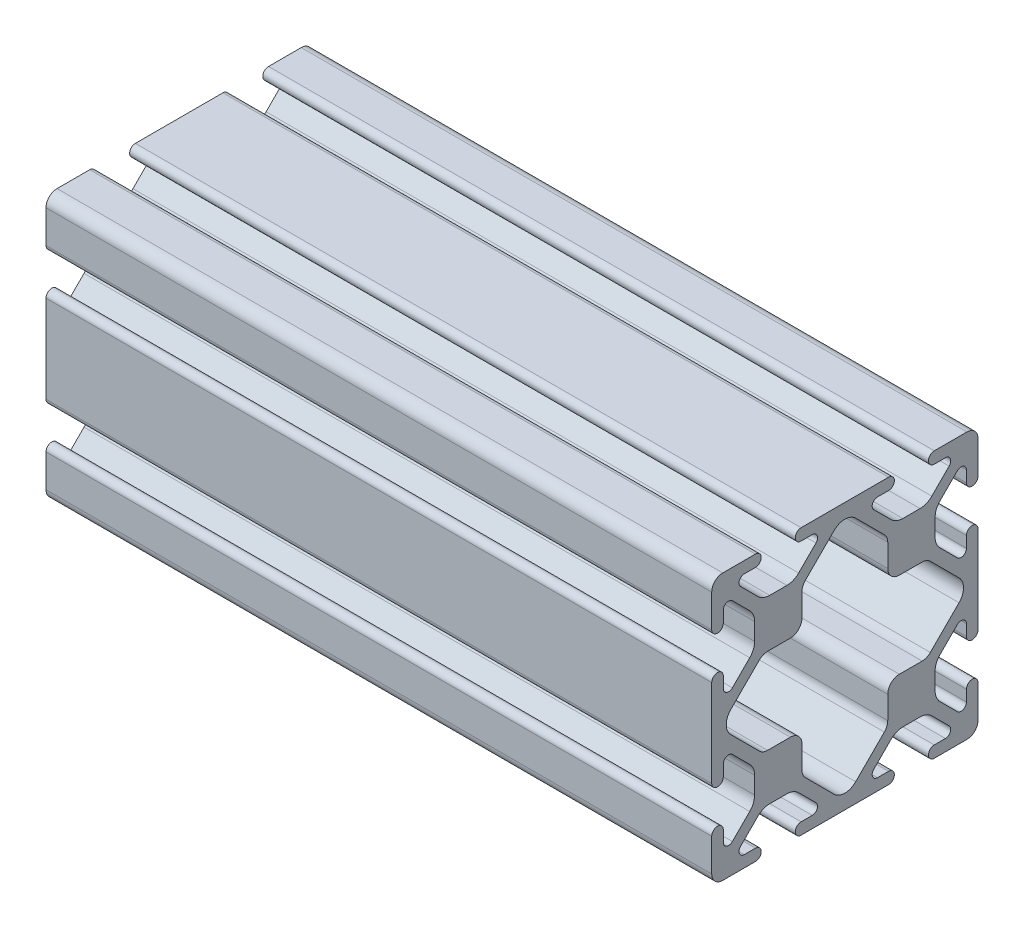
from build123d import *

# Parameters (mm, degrees)
BOSS_EXTRUDE1_DEPTH = 127


with BuildPart() as part:
    # Sketch1 → Boss-Extrude1 (new body)
    with BuildSketch(Plane(origin=(0, 0, 0), x_dir=(0, 0, -1), z_dir=(1, 0, 0))):
        with BuildLine():
            Line((23.1902, 19.174899798), (23.1902, 17.0561))
            ThreePointArc((23.1902, 17.0561), (24.2951, 15.9512), (25.4, 17.0561))
            Line((25.4, 17.0561), (25.4, 23.2918))
            ThreePointArc((25.4, 23.2918), (24.782522516, 24.782522516), (23.2918, 25.4))
            Line((23.2918, 25.4), (17.0561, 25.4))
            ThreePointArc((17.0561, 25.4), (15.9512, 24.2951), (17.0561, 23.1902))
            Line((17.0561, 23.1902), (19.174899798, 23.1902))
            ThreePointArc((19.174899798, 23.1902), (20.113561403, 22.563006367), (19.893320288, 21.45577951))
            Line((19.893320288, 21.45577951), (16.58464389, 18.147103113))
            ThreePointArc((16.58464389, 18.147103113), (15.554599758, 17.458849627), (14.33957986, 17.217167143))
            Line((14.33957986, 17.217167143), (11.06042014, 17.217167143))
            ThreePointArc((11.06042014, 17.217167143), (9.845400242, 17.458849627), (8.81535611, 18.147103113))
            Line((8.81535611, 18.147103113), (5.506679712, 21.45577951))
            ThreePointArc((5.506679712, 21.45577951), (5.286438597, 22.563006367), (6.225100202, 23.1902))
            Line((6.225100202, 23.1902), (8.3439, 23.1902))
            ThreePointArc((8.3439, 23.1902), (9.4488, 24.2951), (8.3439, 25.4))
            Line((8.3439, 25.4), (-8.3439, 25.4))
            ThreePointArc((-8.3439, 25.4), (-9.4488, 24.2951), (-8.3439, 23.1902))
            Line((-8.3439, 23.1902), (-6.225100202, 23.1902))
            ThreePointArc((-6.225100202, 23.1902), (-5.286438597, 22.563006367), (-5.506679712, 21.45577951))
            Line((-5.506679712, 21.45577951), (-8.81535611, 18.147103113))
            ThreePointArc((-8.81535611, 18.147103113), (-9.845400242, 17.458849627), (-11.06042014, 17.217167143))
            Line((-11.06042014, 17.217167143), (-14.33957986, 17.217167143))
            ThreePointArc((-14.33957986, 17.217167143), (-15.554599758, 17.458849627), (-16.58464389, 18.147103113))
            Line((-16.58464389, 18.147103113), (-19.893320288, 21.45577951))
            ThreePointArc((-19.893320288, 21.45577951), (-20.113561403, 22.563006367), (-19.174899798, 23.1902))
            Line((-19.174899798, 23.1902), (-17.0561, 23.1902))
            ThreePointArc((-17.0561, 23.1902), (-15.9512, 24.2951), (-17.0561, 25.4))
            Line((-17.0561, 25.4), (-23.2918, 25.4))
            ThreePointArc((-23.2918, 25.4), (-24.782522516, 24.782522516), (-25.4, 23.2918))
            Line((-25.4, 23.2918), (-25.4, 17.0561))
            ThreePointArc((-25.4, 17.0561), (-24.2951, 15.9512), (-23.1902, 17.0561))
            Line((-23.1902, 17.0561), (-23.1902, 19.174899798))
            ThreePointArc((-23.1902, 19.174899798), (-22.563006367, 20.113561403), (-21.45577951, 19.893320288))
            Line((-21.45577951, 19.893320288), (-18.147103113, 16.58464389))
            ThreePointArc((-18.147103113, 16.58464389), (-17.458849627, 15.554599758), (-17.217167143, 14.33957986))
            Line((-17.217167143, 14.33957986), (-17.217167143, 11.06042014))
            ThreePointArc((-17.217167143, 11.06042014), (-17.458849627, 9.845400242), (-18.147103113, 8.81535611))
            Line((-18.147103113, 8.81535611), (-21.45577951, 5.506679712))
            ThreePointArc((-21.45577951, 5.506679712), (-22.563006367, 5.286438597), (-23.1902, 6.225100202))
            Line((-23.1902, 6.225100202), (-23.1902, 8.3439))
            ThreePointArc((-23.1902, 8.3439), (-24.2951, 9.4488), (-25.4, 8.3439))
            Line((-25.4, 8.3439), (-25.4, -8.3439))
            ThreePointArc((-25.4, -8.3439), (-24.2951, -9.4488), (-23.1902, -8.3439))
            Line((-23.1902, -8.3439), (-23.1902, -6.225100202))
            ThreePointArc((-23.1902, -6.225100202), (-22.563006367, -5.286438597), (-21.45577951, -5.506679712))
            Line((-21.45577951, -5.506679712), (-18.147103113, -8.81535611))
            ThreePointArc((-18.147103113, -8.81535611), (-17.458849627, -9.845400242), (-17.217167143, -11.06042014))
            Line((-17.217167143, -11.06042014), (-17.217167143, -14.33957986))
            ThreePointArc((-17.217167143, -14.33957986), (-17.458849627, -15.554599758), (-18.147103113, -16.58464389))
            Line((-18.147103113, -16.58464389), (-21.45577951, -19.893320288))
            ThreePointArc((-21.45577951, -19.893320288), (-22.563006367, -20.113561403), (-23.1902, -19.174899798))
            Line((-23.1902, -19.174899798), (-23.1902, -17.0561))
            ThreePointArc((-23.1902, -17.0561), (-24.2951, -15.9512), (-25.4, -17.0561))
            Line((-25.4, -17.0561), (-25.4, -23.2918))
            ThreePointArc((-25.4, -23.2918), (-24.782522516, -24.782522516), (-23.2918, -25.4))
            Line((-23.2918, -25.4), (-17.0561, -25.4))
            ThreePointArc((-17.0561, -25.4), (-15.9512, -24.2951), (-17.0561, -23.1902))
            Line((-17.0561, -23.1902), (-19.174899798, -23.1902))
            ThreePointArc((-19.174899798, -23.1902), (-20.113561403, -22.563006367), (-19.893320288, -21.45577951))
            Line((-19.893320288, -21.45577951), (-16.58464389, -18.147103113))
            ThreePointArc((-16.58464389, -18.147103113), (-15.554599758, -17.458849627), (-14.33957986, -17.217167143))
            Line((-14.33957986, -17.217167143), (-11.06042014, -17.217167143))
            ThreePointArc((-11.06042014, -17.217167143), (-9.845400242, -17.458849627), (-8.81535611, -18.147103113))
            Line((-8.81535611, -18.147103113), (-5.506679712, -21.45577951))
            ThreePointArc((-5.506679712, -21.45577951), (-5.286438597, -22.563006367), (-6.225100202, -23.1902))
            Line((-6.225100202, -23.1902), (-8.3439, -23.1902))
            ThreePointArc((-8.3439, -23.1902), (-9.4488, -24.2951), (-8.3439, -25.4))
            Line((-8.3439, -25.4), (8.3439, -25.4))
            ThreePointArc((8.3439, -25.4), (9.4488, -24.2951), (8.3439, -23.1902))
            Line((8.3439, -23.1902), (6.225100202, -23.1902))
            ThreePointArc((6.225100202, -23.1902), (5.286438597, -22.563006367), (5.506679712, -21.45577951))
            Line((5.506679712, -21.45577951), (8.81535611, -18.147103113))
            ThreePointArc((8.81535611, -18.147103113), (9.845400242, -17.458849627), (11.06042014, -17.217167143))
            Line((11.06042014, -17.217167143), (14.33957986, -17.217167143))
            ThreePointArc((14.33957986, -17.217167143), (15.554599758, -17.458849627), (16.58464389, -18.147103113))
            Line((16.58464389, -18.147103113), (19.893320288, -21.45577951))
            ThreePointArc((19.893320288, -21.45577951), (20.113561403, -22.563006367), (19.174899798, -23.1902))
            Line((19.174899798, -23.1902), (17.0561, -23.1902))
            ThreePointArc((17.0561, -23.1902), (15.9512, -24.2951), (17.0561, -25.4))
            Line((17.0561, -25.4), (23.2918, -25.4))
            ThreePointArc((23.2918, -25.4), (24.782522516, -24.782522516), (25.4, -23.2918))
            Line((25.4, -23.2918), (25.4, -17.0561))
            ThreePointArc((25.4, -17.0561), (24.2951, -15.9512), (23.1902, -17.0561))
            Line((23.1902, -17.0561), (23.1902, -19.174899798))
            ThreePointArc((23.1902, -19.174899798), (22.563006367, -20.113561403), (21.45577951, -19.893320288))
            Line((21.45577951, -19.893320288), (18.147103113, -16.58464389))
            ThreePointArc((18.147103113, -16.58464389), (17.458849627, -15.554599758), (17.217167143, -14.33957986))
            Line((17.217167143, -14.33957986), (17.217167143, -11.06042014))
            ThreePointArc((17.217167143, -11.06042014), (17.458849627, -9.845400242), (18.147103113, -8.81535611))
            Line((18.147103113, -8.81535611), (21.45577951, -5.506679712))
            ThreePointArc((21.45577951, -5.506679712), (22.563006367, -5.286438597), (23.1902, -6.225100202))
            Line((23.1902, -6.225100202), (23.1902, -8.3439))
            ThreePointArc((23.1902, -8.3439), (24.2951, -9.4488), (25.4, -8.3439))
            Line((25.4, -8.3439), (25.4, 8.3439))
            ThreePointArc((25.4, 8.3439), (24.2951, 9.4488), (23.1902, 8.3439))
            Line((23.1902, 8.3439), (23.1902, 6.225100202))
            ThreePointArc((23.1902, 6.225100202), (22.563006367, 5.286438597), (21.45577951, 5.506679712))
            Line((21.45577951, 5.506679712), (18.147103113, 8.81535611))
            ThreePointArc((18.147103113, 8.81535611), (17.458849627, 9.845400242), (17.217167143, 11.06042014))
            Line((17.217167143, 11.06042014), (17.217167143, 14.33957986))
            ThreePointArc((17.217167143, 14.33957986), (17.458849627, 15.554599758), (18.147103113, 16.58464389))
            Line((18.147103113, 16.58464389), (21.45577951, 19.893320288))
            ThreePointArc((21.45577951, 19.893320288), (22.563006367, 20.113561403), (23.1902, 19.174899798))
        make_face()
        with BuildLine():
            Line((8.182832857, -10.392632857), (8.182832857, -14.739168105))
            ThreePointArc((8.182832857, -14.739168105), (8.014621848, -15.584821954), (7.535597422, -16.30173267))
            Line((7.535597422, -16.30173267), (2.058651438, -21.778678654))
            ThreePointArc((2.058651438, -21.778678654), (0, -22.6314), (-2.058651438, -21.778678654))
            Line((-2.058651438, -21.778678654), (-7.535597422, -16.30173267))
            ThreePointArc((-7.535597422, -16.30173267), (-8.014621848, -15.584821954), (-8.182832857, -14.739168105))
            Line((-8.182832857, -14.739168105), (-8.182832857, -10.392632857))
            ThreePointArc((-8.182832857, -10.392632857), (-8.830068292, -8.830068292), (-10.392632857, -8.182832857))
            Line((-10.392632857, -8.182832857), (-14.739168105, -8.182832857))
            ThreePointArc((-14.739168105, -8.182832857), (-15.584821954, -8.014621848), (-16.30173267, -7.535597422))
            Line((-16.30173267, -7.535597422), (-21.778678654, -2.058651438))
            ThreePointArc((-21.778678654, -2.058651438), (-22.6314, 0), (-21.778678654, 2.058651438))
            Line((-21.778678654, 2.058651438), (-16.30173267, 7.535597422))
            ThreePointArc((-16.30173267, 7.535597422), (-15.584821954, 8.014621848), (-14.739168105, 8.182832857))
            Line((-14.739168105, 8.182832857), (-10.392632857, 8.182832857))
            ThreePointArc((-10.392632857, 8.182832857), (-8.830068292, 8.830068292), (-8.182832857, 10.392632857))
            Line((-8.182832857, 10.392632857), (-8.182832857, 14.739168105))
            ThreePointArc((-8.182832857, 14.739168105), (-8.014621848, 15.584821954), (-7.535597422, 16.30173267))
            Line((-7.535597422, 16.30173267), (-2.058651438, 21.778678654))
            ThreePointArc((-2.058651438, 21.778678654), (0, 22.6314), (2.058651438, 21.778678654))
            Line((2.058651438, 21.778678654), (7.535597422, 16.30173267))
            ThreePointArc((7.535597422, 16.30173267), (8.014621848, 15.584821954), (8.182832857, 14.739168105))
            Line((8.182832857, 14.739168105), (8.182832857, 10.392632857))
            ThreePointArc((8.182832857, 10.392632857), (8.830068292, 8.830068292), (10.392632857, 8.182832857))
            Line((10.392632857, 8.182832857), (14.739168105, 8.182832857))
            ThreePointArc((14.739168105, 8.182832857), (15.584821954, 8.014621848), (16.30173267, 7.535597422))
            Line((16.30173267, 7.535597422), (21.778678654, 2.058651438))
            ThreePointArc((21.778678654, 2.058651438), (22.6314, 0), (21.778678654, -2.058651438))
            Line((21.778678654, -2.058651438), (16.30173267, -7.535597422))
            ThreePointArc((16.30173267, -7.535597422), (15.584821954, -8.014621848), (14.739168105, -8.182832857))
            Line((14.739168105, -8.182832857), (10.392632857, -8.182832857))
            ThreePointArc((10.392632857, -8.182832857), (8.830068292, -8.830068292), (8.182832857, -10.392632857))
        make_face(mode=Mode.SUBTRACT)
    extrude(amount=-BOSS_EXTRUDE1_DEPTH)


solid = part.part
